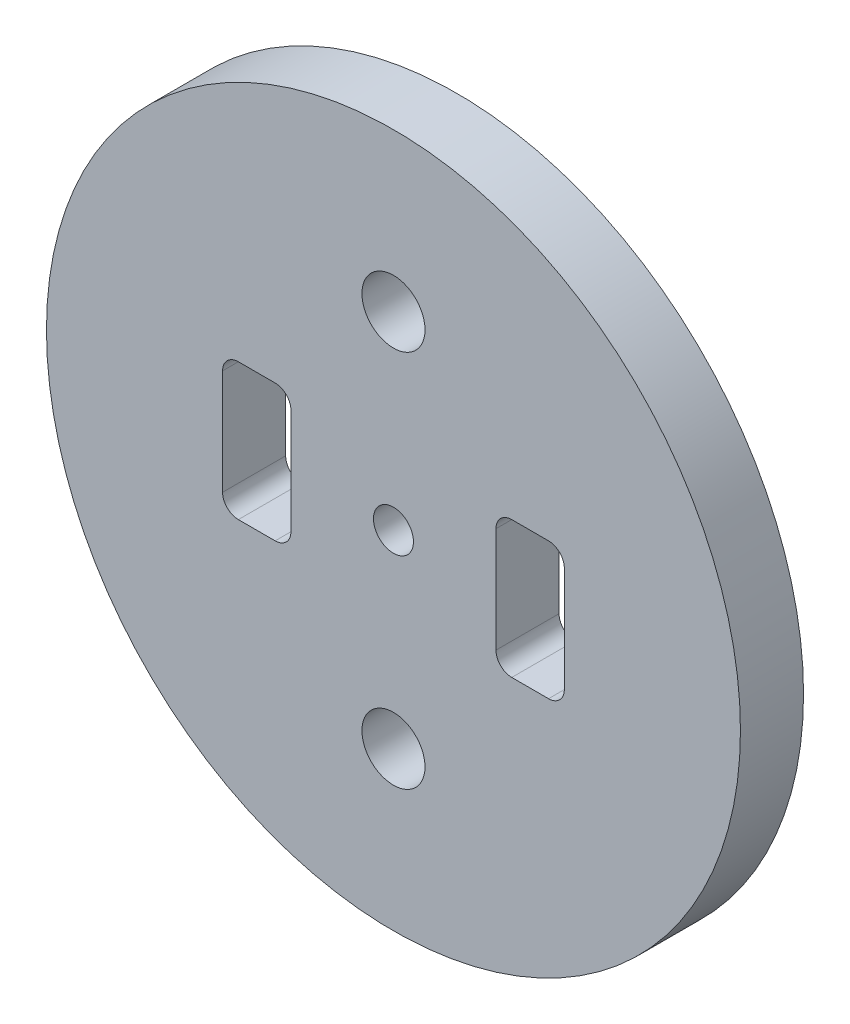
from build123d import *

# Parameters (mm, degrees)
MODEL_R                 = 16.5
MODEL_R_2               = 0.95
MODEL_R_3               = 1.5
SALIENTE_EXTRUIR1_DEPTH = 3


with BuildPart() as part:
    # Model → Saliente-Extruir1 (new body)
    with BuildSketch(Plane.XY):
        with Locations((215.747807914, 241.952019993)):
            Circle(MODEL_R)
        with Locations((215.747807914, 241.952019993)):
            Circle(MODEL_R_2, mode=Mode.SUBTRACT)
        with Locations((215.747807914, 232.952019993)):
            Circle(MODEL_R_3, mode=Mode.SUBTRACT)
        with Locations((215.747807914, 250.952019993)):
            Circle(MODEL_R_3, mode=Mode.SUBTRACT)
        with BuildLine():
            Line((223.122807913, 245.202019993), (221.372807913, 245.202019993))
            ThreePointArc((221.372807913, 245.202019993), (220.842477828, 244.982350079), (220.622807913, 244.452019993))
            Line((220.622807913, 244.452019993), (220.622807913, 239.452019993))
            ThreePointArc((220.622807913, 239.452019993), (220.842477828, 238.921689907), (221.372807913, 238.702019993))
            Line((221.372807913, 238.702019993), (223.122807913, 238.702019993))
            ThreePointArc((223.122807913, 238.702019993), (223.653137999, 238.921689907), (223.872807913, 239.452019993))
            Line((223.872807913, 239.452019993), (223.872807913, 244.452019993))
            ThreePointArc((223.872807913, 244.452019993), (223.653137999, 244.982350079), (223.122807913, 245.202019993))
        make_face(mode=Mode.SUBTRACT)
        with BuildLine():
            Line((208.372807913, 245.202019993), (210.122807913, 245.202019993))
            ThreePointArc((210.122807913, 245.202019993), (210.653137999, 244.982350079), (210.872807913, 244.452019993))
            Line((210.872807913, 244.452019993), (210.872807913, 239.452019993))
            ThreePointArc((210.872807913, 239.452019993), (210.653137999, 238.921689907), (210.122807913, 238.702019993))
            Line((210.122807913, 238.702019993), (208.372807913, 238.702019993))
            ThreePointArc((208.372807913, 238.702019993), (207.842477828, 238.921689907), (207.622807913, 239.452019993))
            Line((207.622807913, 239.452019993), (207.622807913, 244.452019993))
            ThreePointArc((207.622807913, 244.452019993), (207.842477828, 244.982350079), (208.372807913, 245.202019993))
        make_face(mode=Mode.SUBTRACT)
    extrude(amount=SALIENTE_EXTRUIR1_DEPTH)


solid = part.part
